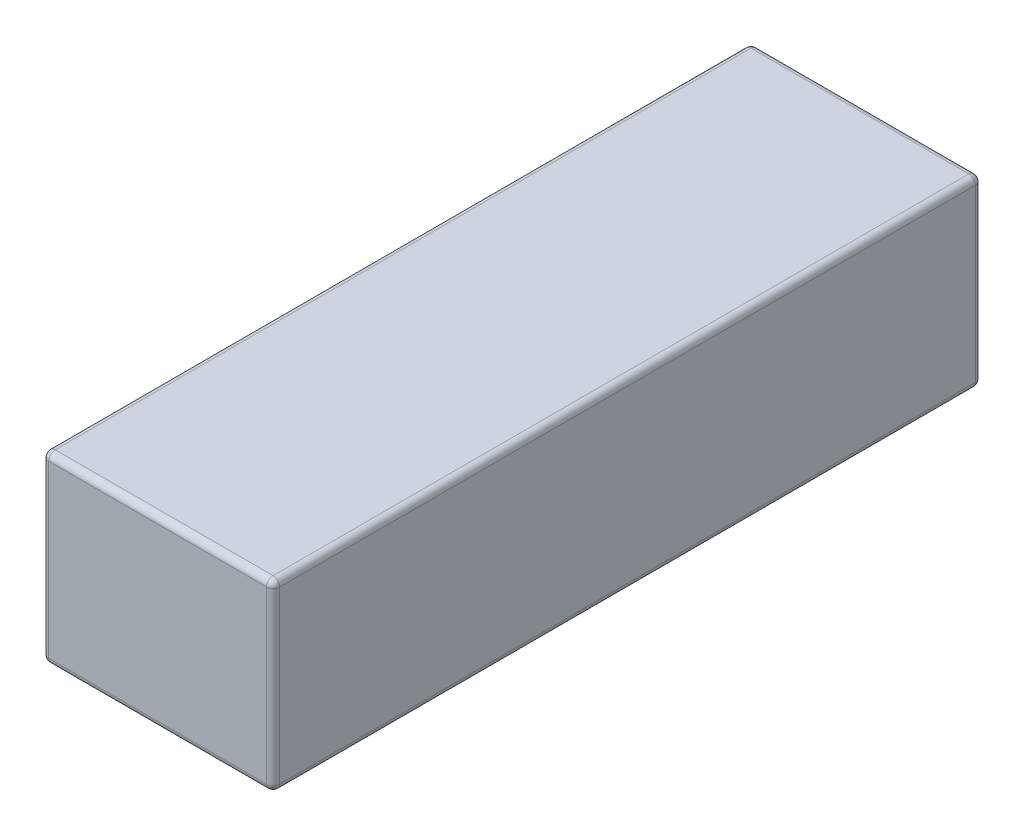
from build123d import *

# Parameters (mm, degrees)
SKETCH1_W           = 135
SKETCH1_H           = 35
BOSS_EXTRUDE1_DEPTH = 44
FILLET1_R           = 1.25


with BuildPart() as part:
    # Sketch1 → Boss-Extrude1 (new body)
    with BuildSketch(Plane(origin=(0, 0, 0), x_dir=(0, 0, -1), z_dir=(1, 0, 0))):
        Rectangle(SKETCH1_W, SKETCH1_H)
    extrude(amount=BOSS_EXTRUDE1_DEPTH)

    # Fillet1
    fillet1_edges = [part.edges().sort_by_distance(p)[0] for p in [
        (44, 0, 67.5),
        (44, -17.5, 0),
        (44, 0, -67.5),
        (0, -17.5, 0),
        (0, 0, 67.5),
        (0, 17.5, 0),
        (0, 0, -67.5),
        (22, -17.5, -67.5),
        (22, -17.5, 67.5),
        (22, 17.5, 67.5),
        (22, 17.5, -67.5),
        (44, 17.5, 0),
    ]]
    fillet(fillet1_edges, radius=FILLET1_R)


solid = part.part
